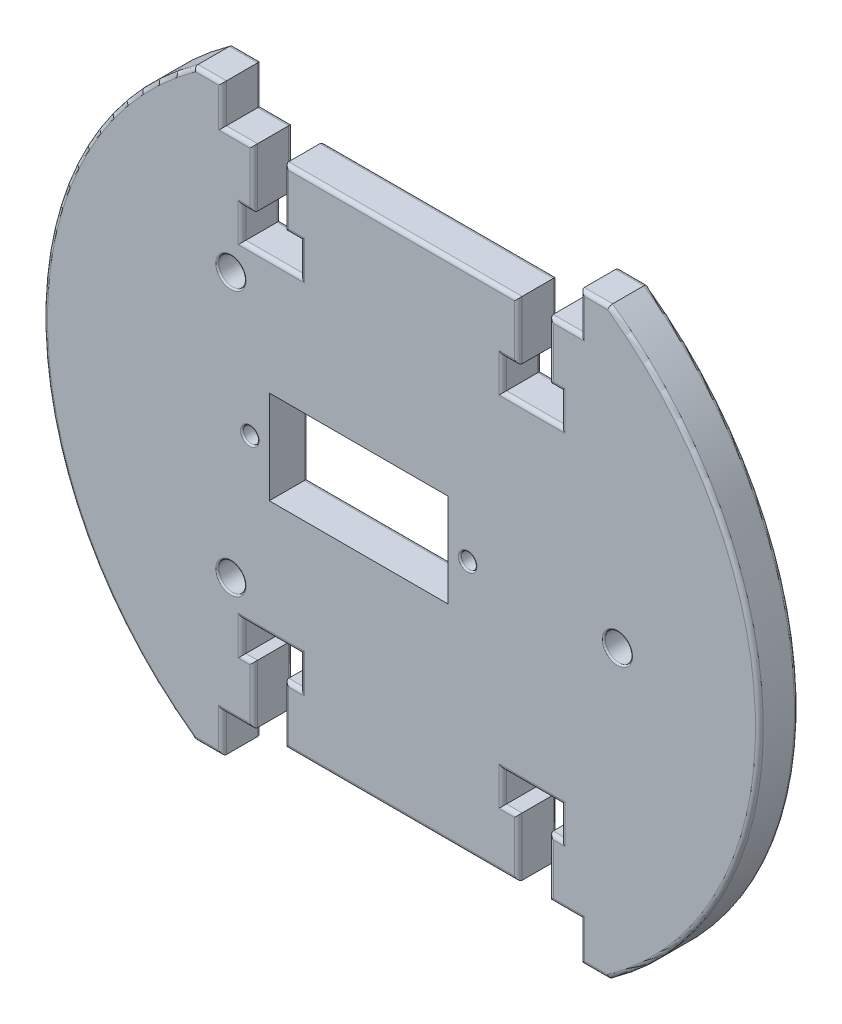
from build123d import *

# Parameters (mm, degrees)
SKETCH1_R           = 1
SKETCH1_R_2         = 1.75
SKETCH1_W           = 23
SKETCH1_H           = 12
BOSS_EXTRUDE1_DEPTH = 5
SKETCH3_W           = 4
SKETCH3_H           = 7.5
SKETCH3_W_2         = 7.5
SKETCH3_H_2         = 4
CUT_EXTRUDE1_DEPTH  = 5
FILLET1_R           = 0.5
FILLET2_R           = 0.5
FILLET3_R           = 0.2
FILLET4_R           = 0.2


with BuildPart() as part:
    # Sketch1 → Boss-Extrude1 (new body)
    with BuildSketch(Plane.XY):
        with BuildLine():
            Line((26.64113361, 37.5), (23, 37.5))
            Line((23, 37.5), (23, 32.5))
            Line((23, 32.5), (-23, 32.5))
            Line((-23, 32.5), (-23, 37.5))
            Line((-23, 37.5), (-26.64113361, 37.5))
            ThreePointArc((-26.64113361, 37.5), (-46, 0), (-26.64113361, -37.5))
            Line((-26.64113361, -37.5), (-23, -37.5))
            Line((-23, -37.5), (-23, -32.5))
            Line((-23, -32.5), (23, -32.5))
            Line((23, -32.5), (23, -37.5))
            Line((23, -37.5), (26.64113361, -37.5))
            ThreePointArc((26.64113361, -37.5), (46, 0), (26.64113361, 37.5))
        make_face()
        with Locations((8.5, 0)):
            Circle(SKETCH1_R, mode=Mode.SUBTRACT)
        with Locations((-19.5, 0)):
            Circle(SKETCH1_R, mode=Mode.SUBTRACT)
        with Locations((-21.93, -17)):
            Circle(SKETCH1_R_2, mode=Mode.SUBTRACT)
        with Locations((-21.93, 17)):
            Circle(SKETCH1_R_2, mode=Mode.SUBTRACT)
        with Locations((27.75, 0)):
            Circle(SKETCH1_R_2, mode=Mode.SUBTRACT)
        with Locations((-5.5, 0)):
            Rectangle(SKETCH1_W, SKETCH1_H, mode=Mode.SUBTRACT)
    extrude(amount=BOSS_EXTRUDE1_DEPTH)

    # Sketch3 → Cut-Extrude1 (cut)
    with BuildSketch(Plane(origin=(0, 0, 0), x_dir=(-1, 0, 0), z_dir=(0, 0, -1))):
        with Locations((17, 28.75)):
            Rectangle(SKETCH3_W, SKETCH3_H)
        with Locations((16.75, 23)):
            Rectangle(SKETCH3_W_2, SKETCH3_H_2)
        with Locations((-17, 28.75)):
            Rectangle(SKETCH3_W, SKETCH3_H)
        Polygon((-13, 25), (-15, 25), (-19, 25), (-20.5, 25), (-20.5, 21), (-13, 21), align=None)
        with Locations((-16.75, -23)):
            Rectangle(SKETCH3_W_2, SKETCH3_H_2)
        with Locations((-17, -28.75)):
            Rectangle(SKETCH3_W, SKETCH3_H)
        with Locations((17, -28.75)):
            Rectangle(SKETCH3_W, SKETCH3_H)
        Polygon((20.5, -25), (20.5, -21), (13, -21), (13, -25), (15, -25), (19, -25), align=None)
    extrude(amount=-CUT_EXTRUDE1_DEPTH, mode=Mode.SUBTRACT)

    # Fillet1
    fillet1_edges = [part.edges().sort_by_distance(p)[0] for p in [
        (-15, -28.75, 0),
        (-14, -25, 0),
        (-13, -23, 0),
        (-19.75, -25, 0),
        (-19, -28.75, 0),
        (-20.5, -23, 0),
        (-16.75, -21, 0),
        (20.5, -23, 0),
        (16.75, -21, 0),
        (19, -28.75, 0),
        (19.75, -25, 0),
        (15, -28.75, 0),
        (14, -25, 0),
        (13, -23, 0),
        (23, -35, 0),
        (-21, -32.5, 0),
        (15, 28.75, 0),
        (14, 25, 0),
        (13, 23, 0),
        (-23, -35, 0),
        (19.75, 25, 0),
        (19, 28.75, 0),
        (20.5, 23, 0),
        (16.75, 21, 0),
        (-24.820566805, -37.5, 0),
        (-46, 0, 0),
        (-19, 28.75, 0),
        (-20.5, 23, 0),
        (-16.75, 21, 0),
        (-24.820566805, 37.5, 0),
        (-15, 28.75, 0),
        (-14, 25, 0),
        (-13, 23, 0),
        (-19.75, 25, 0),
        (-23, 35, 0),
        (21, 32.5, 0),
        (23, 35, 0),
        (24.820566805, 37.5, 0),
        (46, 0, 0),
        (24.820566805, -37.5, 0),
        (6, 0, 0),
        (-5.5, 6, 0),
        (-17, 0, 0),
        (-5.5, -6, 0),
        (0, -32.5, 0),
        (21, -32.5, 0),
        (0, 32.5, 0),
        (-21, 32.5, 0),
    ]]
    fillet(fillet1_edges, radius=FILLET1_R)

    # Fillet2
    fillet2_edges = [part.edges().sort_by_distance(p)[0] for p in [
        (-16.75, -21, 5),
        (-20.5, -23, 5),
        (-19, -28.75, 5),
        (-15, -28.75, 5),
        (-14, -25, 5),
        (-13, -23, 5),
        (-19.75, -25, 5),
        (13, -23, 5),
        (14, -25, 5),
        (15, -28.75, 5),
        (19.75, -25, 5),
        (20.5, -23, 5),
        (16.75, -21, 5),
        (19, -28.75, 5),
        (16.75, 21, 5),
        (20.5, 23, 5),
        (24.820566805, 37.5, 5),
        (19, 28.75, 5),
        (15, 28.75, 5),
        (14, 25, 5),
        (13, 23, 5),
        (19.75, 25, 5),
        (-19.75, 25, 5),
        (-13, 23, 5),
        (-14, 25, 5),
        (-15, 28.75, 5),
        (-19, 28.75, 5),
        (-20.5, 23, 5),
        (-16.75, 21, 5),
        (23, 35, 5),
        (21, 32.5, 5),
        (-23, 35, 5),
        (-24.820566805, 37.5, 5),
        (-46, 0, 5),
        (-24.820566805, -37.5, 5),
        (-23, -35, 5),
        (-21, -32.5, 5),
        (23, -35, 5),
        (24.820566805, -37.5, 5),
        (0, -32.5, 5),
        (21, -32.5, 5),
        (0, 32.5, 5),
        (-21, 32.5, 5),
        (46, 0, 5),
    ]]
    fillet(fillet2_edges, radius=FILLET2_R)

    # Fillet3
    fillet3_edges = [part.edges().sort_by_distance(p)[0] for p in [
        (7.5, 0, 5),
        (-20.5, 0, 5),
        (-23.68, -17, 5),
        (-23.68, 17, 0),
        (-23.68, 17, 5),
        (26, 0, 0),
        (26, 0, 5),
    ]]
    fillet(fillet3_edges, radius=FILLET3_R)

    # Fillet4
    fillet4_edges = [part.edges().sort_by_distance(p)[0] for p in [
        (7.5, 0, 0),
        (-20.5, 0, 0),
        (-23.68, -17, 0),
    ]]
    fillet(fillet4_edges, radius=FILLET4_R)


solid = part.part
